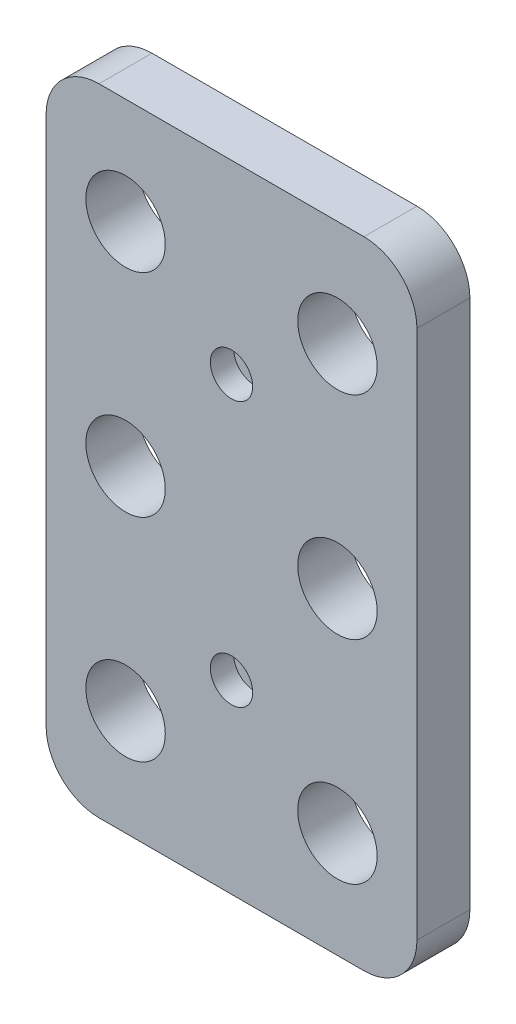
from build123d import *

# Parameters (mm, degrees)
SKETCH_1_R          = 7.5
SKETCH_1_R_2        = 2.25
EXTRUDE_1_DEPTH     = 10
SKETCH_2_R          = 4
CUT_EXTRUDE_1_DEPTH = 4.4


with BuildPart() as part:
    # 草图1 → 凸台-拉伸1 (new body)
    with BuildSketch(Plane.XY):
        with BuildLine():
            Line((-25, -60), (25, -60))
            ThreePointArc((25, -60), (32.071067812, -57.071067812), (35, -50))
            Line((35, -50), (35, 50))
            ThreePointArc((35, 50), (32.071067812, 57.071067812), (25, 60))
            Line((25, 60), (-25, 60))
            ThreePointArc((-25, 60), (-32.071067812, 57.071067812), (-35, 50))
            Line((-35, 50), (-35, -50))
            ThreePointArc((-35, -50), (-32.071067812, -57.071067812), (-25, -60))
        make_face()
        with Locations((20, 40)):
            Circle(SKETCH_1_R, mode=Mode.SUBTRACT)
        with Locations((20, 0)):
            Circle(SKETCH_1_R, mode=Mode.SUBTRACT)
        with Locations(Location((20, -40, 0), (0, 0, 180))):
            Circle(SKETCH_1_R, mode=Mode.SUBTRACT)
        with Locations((-20, -40)):
            Circle(SKETCH_1_R, mode=Mode.SUBTRACT)
        with Locations(Location((-20, 0, 0), (0, 0, 180))):
            Circle(SKETCH_1_R, mode=Mode.SUBTRACT)
        with Locations(Location((-20, 40, 0), (0, 0, 180))):
            Circle(SKETCH_1_R, mode=Mode.SUBTRACT)
        with Locations((0, 25)):
            Circle(SKETCH_1_R_2, mode=Mode.SUBTRACT)
        with Locations(Location((0, -25, 0), (0, 0, 180))):
            Circle(SKETCH_1_R_2, mode=Mode.SUBTRACT)
    extrude(amount=EXTRUDE_1_DEPTH)

    # 草图2 → 切除-拉伸1 (cut)
    with BuildSketch(Plane.XY.offset(10)):
        with Locations((0, 25)):
            Circle(SKETCH_2_R)
        with Locations((0, -25)):
            Circle(SKETCH_2_R)
    extrude(amount=-CUT_EXTRUDE_1_DEPTH, mode=Mode.SUBTRACT)


solid = part.part
